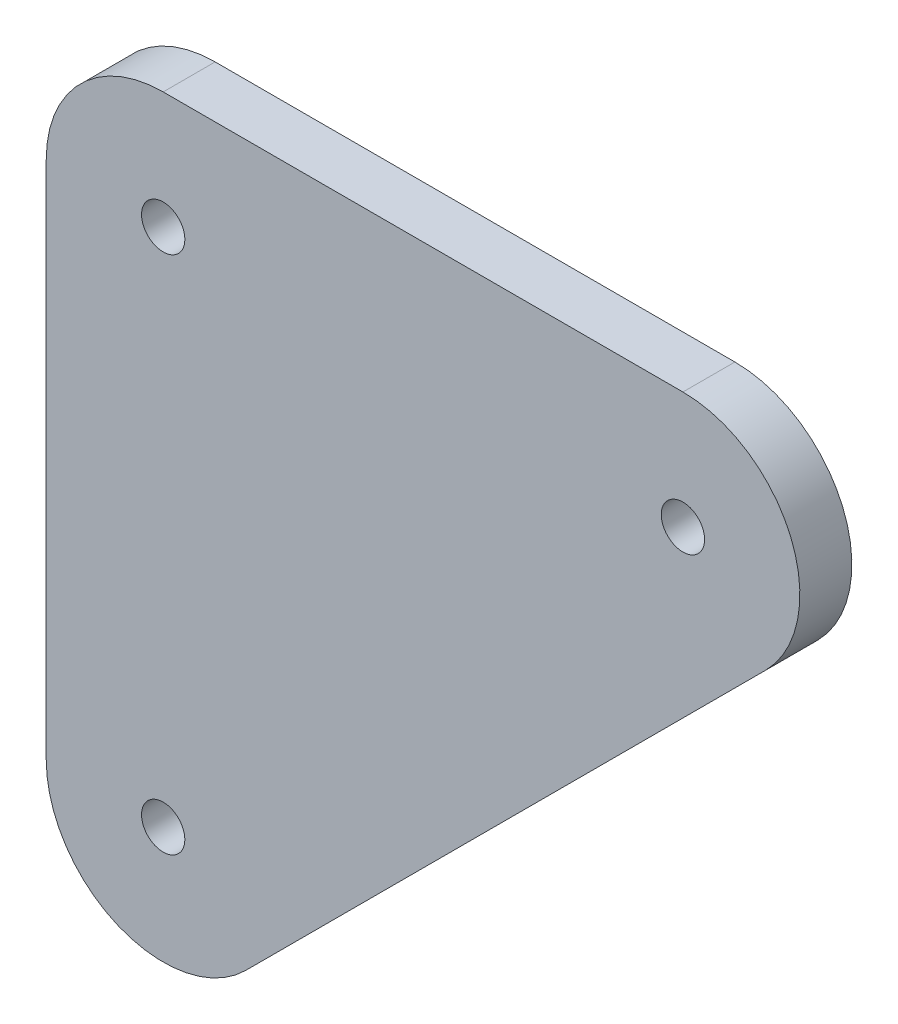
from build123d import *

# Parameters (mm, degrees)
ESBO_O1_R                = 2.5
RESSALTO_EXTRUS_O1_DEPTH = 6


with BuildPart() as part:
    # Esboço1 → Ressalto-extrusão1 (new body)
    with BuildSketch(Plane.XY):
        with BuildLine():
            Line((30, 43.5), (-30, 43.5))
            ThreePointArc((-30, 43.5), (-39.545941546, 39.545941546), (-43.5, 30))
            Line((-43.5, 30), (-43.5, -30))
            ThreePointArc((-43.5, -30), (-35.166226337, -42.472373689), (-20.454058454, -39.545941546))
            Line((-20.454058454, -39.545941546), (39.545941546, 20.454058454))
            ThreePointArc((39.545941546, 20.454058454), (42.472373689, 35.166226337), (30, 43.5))
        make_face()
        with Locations((-30, 30)):
            Circle(ESBO_O1_R, mode=Mode.SUBTRACT)
        with Locations((-30, -30)):
            Circle(ESBO_O1_R, mode=Mode.SUBTRACT)
        with Locations((30, 30)):
            Circle(ESBO_O1_R, mode=Mode.SUBTRACT)
    extrude(amount=RESSALTO_EXTRUS_O1_DEPTH)


solid = part.part
